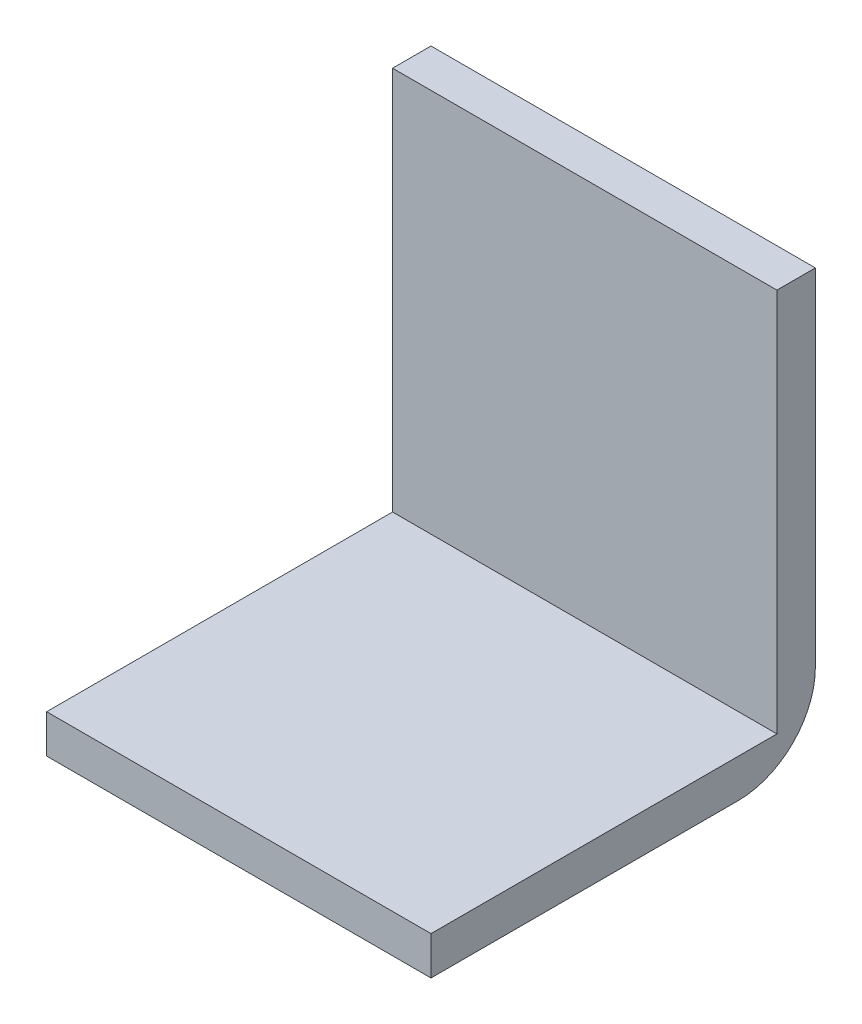
from build123d import *

# Parameters (mm, degrees)
SKETCH1_W           = 50
SKETCH1_H           = 55
BOSS_EXTRUDE1_DEPTH = 50
SKETCH2_W           = 50
SKETCH2_H           = 50
CUT_EXTRUDE1_DEPTH  = 45
FILLET2_R           = 10


with BuildPart() as part:
    # Sketch1 → Boss-Extrude1 (new body)
    with BuildSketch(Plane.XY):
        with Locations((9.585987261, 0.398089172)):
            Rectangle(SKETCH1_W, SKETCH1_H)
    extrude(amount=BOSS_EXTRUDE1_DEPTH)

    # Sketch2 → Cut-Extrude1 (cut)
    with BuildSketch(Plane.XY.offset(50)):
        with Locations((9.585987261, 2.898089172)):
            Rectangle(SKETCH2_W, SKETCH2_H)
    extrude(amount=-CUT_EXTRUDE1_DEPTH, mode=Mode.SUBTRACT)

    # Fillet2
    fillet2_edges = [part.edges().sort_by_distance(p)[0] for p in [
        (9.585987261, -27.101910828, 0),
    ]]
    fillet(fillet2_edges, radius=FILLET2_R)


solid = part.part
